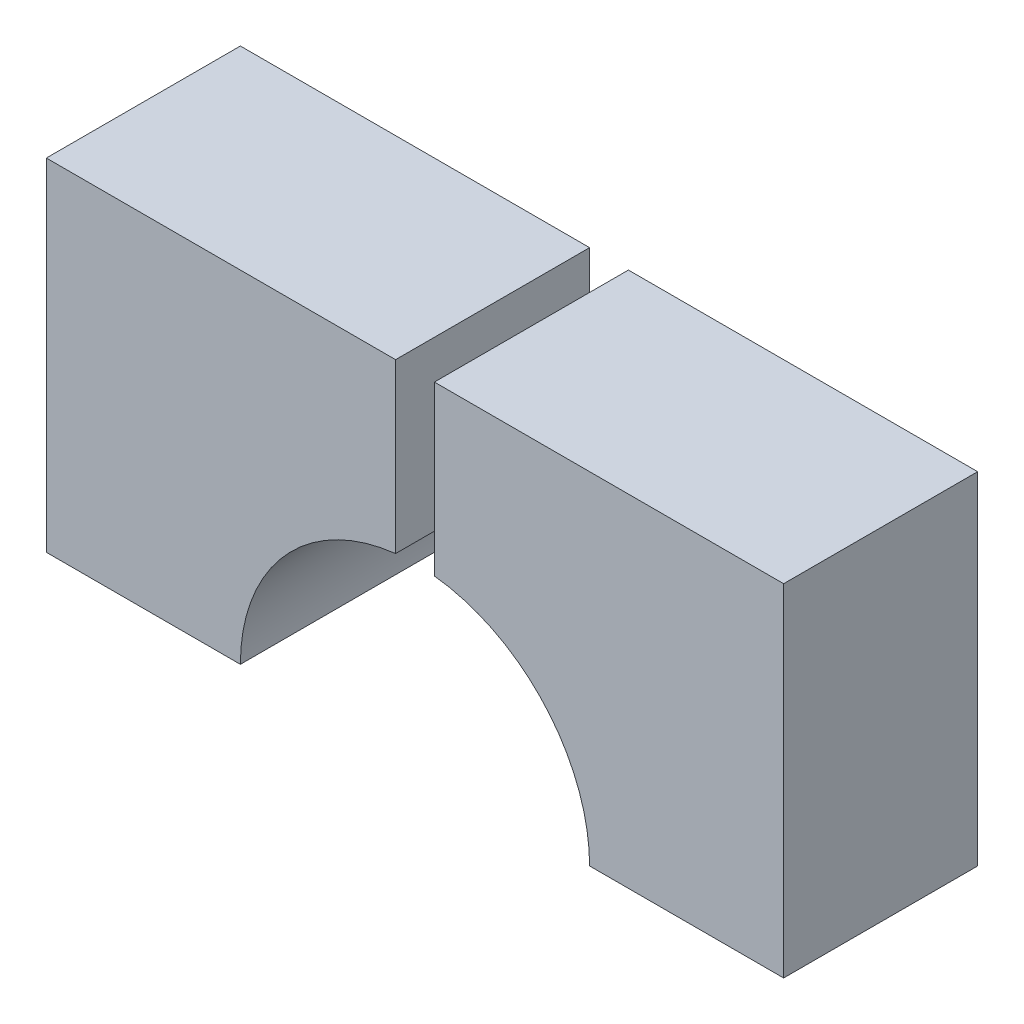
from build123d import *

# Parameters (mm, degrees)
BOSS_EXTRUDE1_START = -30
BOSS_EXTRUDE1_DEPTH = 100


with BuildPart() as part:
    # Sketch2 → Boss-Extrude1 (new body)
    with BuildSketch(Plane.XY.offset(BOSS_EXTRUDE1_START)):
        with BuildLine():
            Line((90, -505.650336196), (190, -505.650336196))
            Line((190, -505.650336196), (190, -329.650336196))
            Line((190, -329.650336196), (10, -329.650336196))
            Line((10, -329.650336196), (10, -416.207617096))
            ThreePointArc((10, -416.207617096), (67.082039325, -445.650336196), (90, -505.650336196))
        make_face()
    extrude(amount=-BOSS_EXTRUDE1_DEPTH)


with BuildPart() as body_2:
    # Mirror3: mirrored copy
    add(part.part.mirror(Plane(origin=(0, 0, 0), x_dir=(0, 0, 1), z_dir=(1, 0, 0))))


solid = Compound([part.part, body_2.part])
